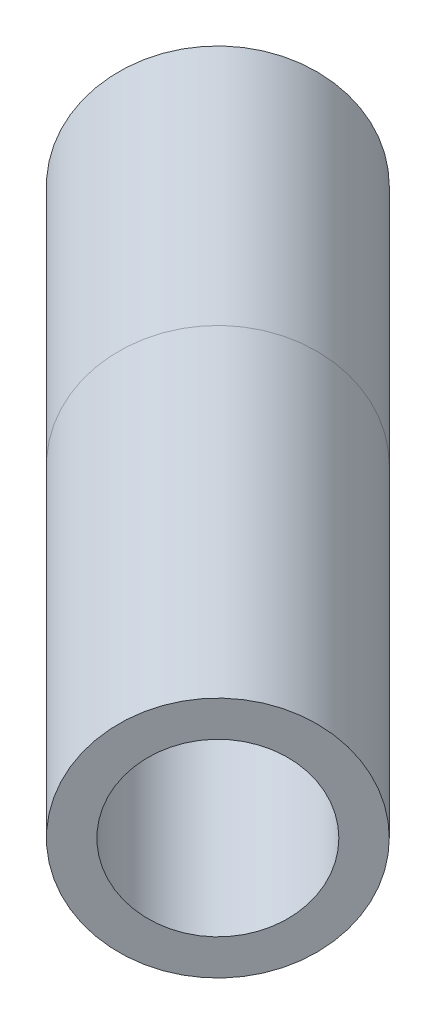
from build123d import *

# Parameters (mm, degrees)
SWEEP1_PROFILE_R     = 13.49375
CUT_SWEEP1_PROFILE_R = 9.525


with BuildPart() as part:
    # Sweep1: sweep along a path in Sketch1
    with BuildLine(Plane(origin=(0, 0, 0), x_dir=(1, 0, 0), z_dir=(0, 1, 0))) as sweep1_path:
        Line((0, 0), (-35.921024484, 35.921024484))
        Line((-35.921024484, 35.921024484), (-62.861792847, 62.861792847))
    # Sweep1 profile (on start of the path) → Sweep1 (sweep)
    with BuildSketch(Plane(origin=(0, 0, 0), x_dir=(-0.7071067811865476, 0, 0.7071067811865476), z_dir=(-0.7071067811865476, 0, -0.7071067811865476))):
        Circle(SWEEP1_PROFILE_R)
    sweep(path=sweep1_path.line)

    # Cut-Sweep1: sweep along a path in Sketch1<3>
    with BuildLine(Plane(origin=(0, 0, 0), x_dir=(1, 0, 0), z_dir=(0, 1, 0))) as cut_sweep1_path:
        Line((0, 0), (-35.921024484, 35.921024484))
        Line((-35.921024484, 35.921024484), (-62.861792847, 62.861792847))
    # Cut-Sweep1 profile (on start of the path) → Cut-Sweep1 (sweep, cut)
    with BuildSketch(Plane(origin=(0, 0, 0), x_dir=(-0.7071067811865476, 0, 0.7071067811865476), z_dir=(-0.7071067811865476, 0, -0.7071067811865476))):
        Circle(CUT_SWEEP1_PROFILE_R)
    sweep(path=cut_sweep1_path.line, mode=Mode.SUBTRACT)


solid = part.part
